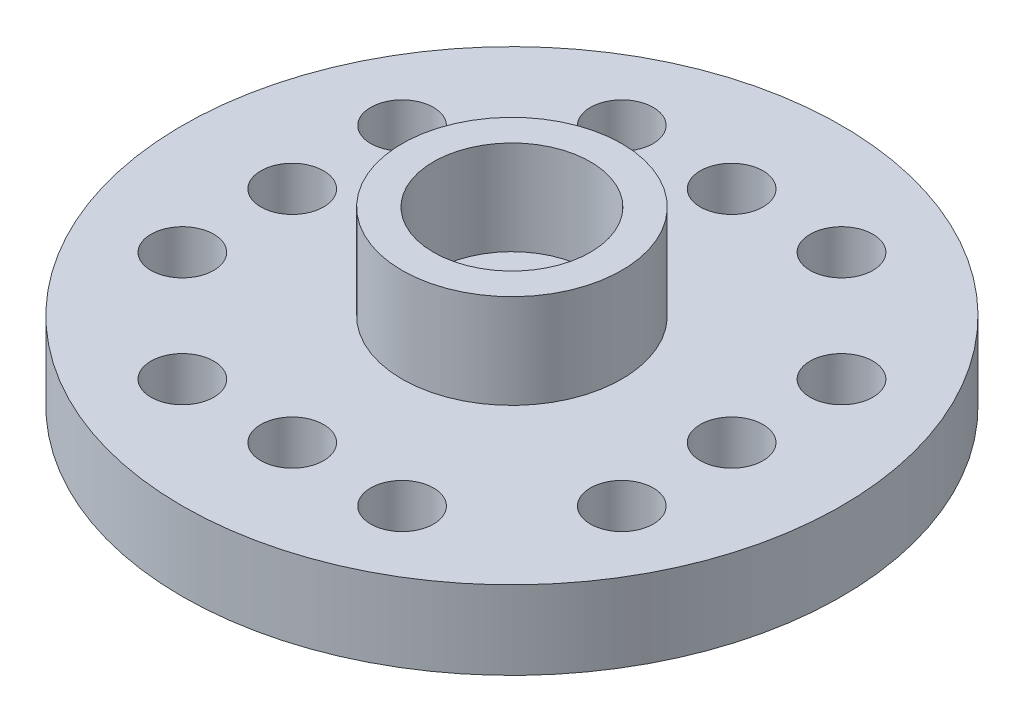
from build123d import *

# Parameters (mm, degrees)
SKETCH1_R           = 10.5
BOSS_EXTRUDE1_DEPTH = 2.5
SKETCH2_R           = 3.5
SKETCH2_R_2         = 2.5
BOSS_EXTRUDE2_DEPTH = 3
SKETCH3_R           = 1.5
CUT_EXTRUDE1_DEPTH  = 3
CUT_EXTRUDE2_START  = -1.5
SKETCH4_R           = 4.5
SKETCH4_R_2         = 1.5
CUT_EXTRUDE2_DEPTH  = 1.5
SKETCH5_R           = 1
CUT_EXTRUDE3_DEPTH  = 3


with BuildPart() as part:
    # Sketch1 → Boss-Extrude1 (new body)
    with BuildSketch(Plane(origin=(0, 0, 0), x_dir=(1, 0, 0), z_dir=(0, 1, 0))):
        with Locations(Location((0, 0, 0), (0, 0, 270))):
            Circle(SKETCH1_R)
    extrude(amount=BOSS_EXTRUDE1_DEPTH)

    # Sketch2 → Boss-Extrude2 (add)
    with BuildSketch(Plane(origin=(0, 2.5, 0), x_dir=(1, 0, 0), z_dir=(0, 1, 0))):
        with Locations(Location((0, 0, 0), (0, 0, 270))):
            Circle(SKETCH2_R)
        with Locations(Location((0, 0, 0), (0, 0, 270))):
            Circle(SKETCH2_R_2, mode=Mode.SUBTRACT)
    extrude(amount=BOSS_EXTRUDE2_DEPTH)

    # Sketch3 → Cut-Extrude1 (cut)
    with BuildSketch(Plane(origin=(0, 2.5, 0), x_dir=(1, 0, 0), z_dir=(0, 1, 0))):
        with Locations(Location((0, 0, 0), (0, 0, 270))):
            Circle(SKETCH3_R)
    extrude(amount=-CUT_EXTRUDE1_DEPTH, mode=Mode.SUBTRACT)

    # Sketch4 → Cut-Extrude2 (cut)
    with BuildSketch(Plane.XZ.offset(CUT_EXTRUDE2_START)):
        with Locations(Location((0, 0, 0), (0, 0, 270))):
            Circle(SKETCH4_R)
        with Locations(Location((0, 0, 0), (0, 0, 90))):
            Circle(SKETCH4_R_2, mode=Mode.SUBTRACT)
    extrude(amount=CUT_EXTRUDE2_DEPTH, mode=Mode.SUBTRACT)

    # Sketch5 → Cut-Extrude3 (cut)
    with BuildSketch(Plane.XZ):
        with Locations(Location((0, 7, 0), (0, 0, 270))):
            Circle(SKETCH5_R)
        with Locations(Location((3.5, 7, 0), (0, 0, 270))):
            Circle(SKETCH5_R)
        with Locations(Location((-3.5, 7, 0), (0, 0, 270))):
            Circle(SKETCH5_R)
        with Locations(Location((7, 3.5, 0), (0, 0, 270))):
            Circle(SKETCH5_R)
        with Locations(Location((7, 0, 0), (0, 0, 270))):
            Circle(SKETCH5_R)
        with Locations(Location((7, -3.5, 0), (0, 0, 270))):
            Circle(SKETCH5_R)
        with Locations(Location((3.5, -7, 0), (0, 0, 270))):
            Circle(SKETCH5_R)
        with Locations(Location((0, -7, 0), (0, 0, 270))):
            Circle(SKETCH5_R)
        with Locations(Location((-3.5, -7, 0), (0, 0, 270))):
            Circle(SKETCH5_R)
        with Locations(Location((-7, -3.5, 0), (0, 0, 270))):
            Circle(SKETCH5_R)
        with Locations(Location((-7, 0, 0), (0, 0, 270))):
            Circle(SKETCH5_R)
        with Locations(Location((-7, 3.5, 0), (0, 0, 270))):
            Circle(SKETCH5_R)
    extrude(amount=-CUT_EXTRUDE3_DEPTH, mode=Mode.SUBTRACT)


solid = part.part
